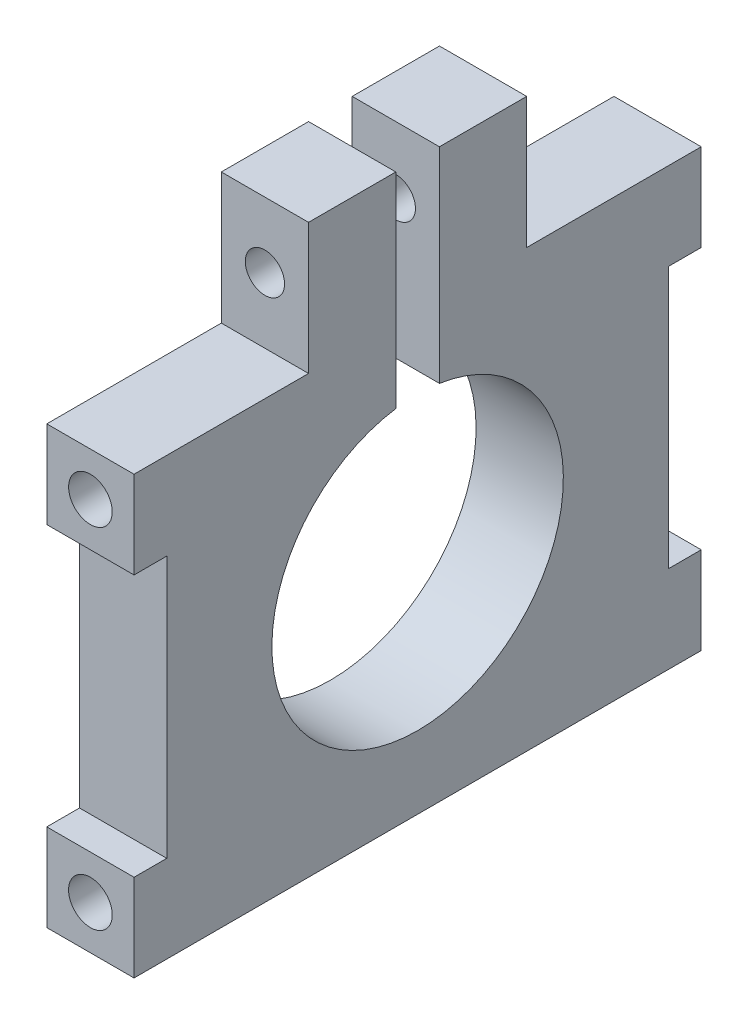
from build123d import *

# Parameters (mm, degrees)
CROQUIS1_W              = 65
CROQUIS1_H              = 50
CROQUIS1_R              = 16.7005
SALIENTE_EXTRUIR1_DEPTH = 5
CROQUIS2_W              = 7.5
CROQUIS2_H              = 30
CORTAR_EXTRUIR1_DEPTH   = 43.20485754
CROQUIS3_W              = 5
CROQUIS3_H              = 15
CORTAR_EXTRUIR2_DEPTH   = 43.20485754
CROQUIS4_W              = 10
CROQUIS4_H              = 15
SALIENTE_EXTRUIR2_DEPTH = 10
CROQUIS5_R              = 2.5
CORTAR_EXTRUIR3_DEPTH   = 10
CORTAR_EXTRUIR4_REACH   = 62.415
CROQUIS6_R              = 2.25


with BuildPart() as part:
    # Croquis1 → Saliente-Extruir1 (new, symmetric)
    with BuildSketch(Plane(origin=(0, 0, 0), x_dir=(0, 0, -1), z_dir=(1, 0, 0))):
        Rectangle(CROQUIS1_W, CROQUIS1_H)
        Circle(CROQUIS1_R, mode=Mode.SUBTRACT)
    extrude(amount=SALIENTE_EXTRUIR1_DEPTH, both=True)

    # Croquis2 → Cortar-Extruir1 (cut, through all)
    with BuildSketch(Plane(origin=(5, 0, 0), x_dir=(0, 0, -1), z_dir=(1, 0, 0))):
        with Locations((-32.5, 0)):
            Rectangle(CROQUIS2_W, CROQUIS2_H)
        with Locations((32.5, 0)):
            Rectangle(CROQUIS2_W, CROQUIS2_H)
    extrude(amount=-CORTAR_EXTRUIR1_DEPTH, mode=Mode.SUBTRACT)

    # Croquis3 → Cortar-Extruir2 (cut, through all)
    with BuildSketch(Plane(origin=(5, 0, 0), x_dir=(0, 0, -1), z_dir=(1, 0, 0))):
        with Locations((0, 20.85025)):
            Rectangle(CROQUIS3_W, CROQUIS3_H)
    extrude(amount=-CORTAR_EXTRUIR2_DEPTH, mode=Mode.SUBTRACT)

    # Croquis4 → Saliente-Extruir2 (add)
    with BuildSketch(Plane(origin=(5, 0, 0), x_dir=(0, 0, -1), z_dir=(1, 0, 0))):
        with Locations((-7.5, 32.5)):
            Rectangle(CROQUIS4_W, CROQUIS4_H)
        with Locations((7.5, 32.5)):
            Rectangle(CROQUIS4_W, CROQUIS4_H)
    extrude(amount=-SALIENTE_EXTRUIR2_DEPTH)

    # Croquis5 → Cortar-Extruir3 (cut)
    with BuildSketch(Plane.XY.offset(32.5)):
        with Locations((0, 20)):
            Circle(CROQUIS5_R)
        with Locations(Location((0, -20, 0), (0, 0, 180))):
            Circle(CROQUIS5_R)
    cortar_extruir3 = extrude(amount=-CORTAR_EXTRUIR3_DEPTH, mode=Mode.SUBTRACT)

    # Simetría1: Cortar-Extruir3 across plane
    add(cortar_extruir3.mirror(Plane.XY), mode=Mode.SUBTRACT)

    # Cortar-Extruir4: up to this face of the body (flat: up to its plane)
    cortar_extruir4_end = Plane(part.part.faces().sort_by_distance((0, 32.5, -12.5))[0])
    # Croquis6 → Cortar-Extruir4 (cut, up to the picked face)
    with BuildSketch(Plane.XY.offset(12.5), mode=Mode.PRIVATE) as cortar_extruir4_sk1:
        with Locations((0, 32.5)):
            Circle(CROQUIS6_R)
    cortar_extruir4_tool1 = split(extrude(cortar_extruir4_sk1.sketch, amount=-CORTAR_EXTRUIR4_REACH, mode=Mode.PRIVATE), bisect_by=cortar_extruir4_end, keep=Keep.BOTH, mode=Mode.PRIVATE)
    add(cortar_extruir4_tool1.solids().sort_by(Axis((0, 32.5, 12.5), (0, 0, -1)))[0], mode=Mode.SUBTRACT)


solid = part.part
